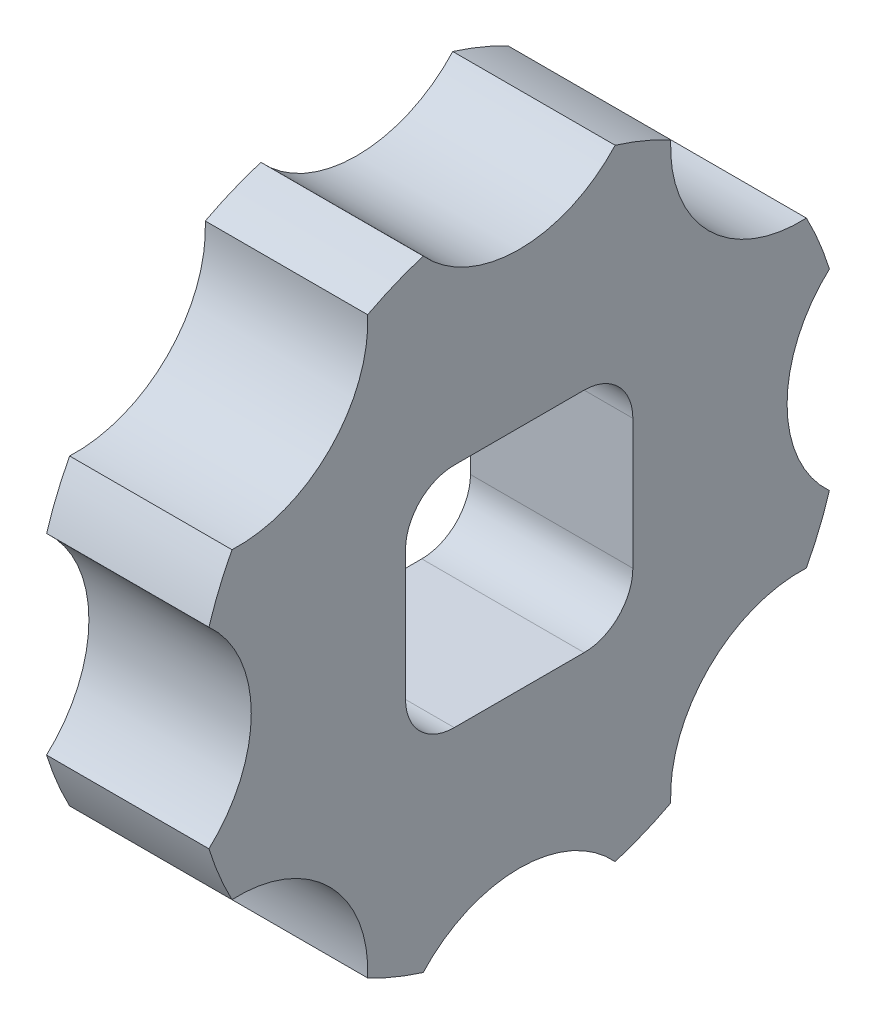
from build123d import *

# Parameters (mm, degrees)
SKETCH1_R           = 20
BOSS_EXTRUDE1_DEPTH = 10
SKETCH2_W           = 14
SKETCH2_H           = 14
CUT_EXTRUDE1_DEPTH  = 10
FILLET1_R           = 3
SKETCH3_R           = 8
CUT_EXTRUDE2_DEPTH  = 10
SKETCH3_3_R         = 8
CUT_EXTRUDE3_DEPTH  = 10
CIRPATTERN2_COUNT   = 8


with BuildPart() as part:
    # Sketch1 → Boss-Extrude1 (new body)
    with BuildSketch(Plane(origin=(0, 0, 0), x_dir=(0, 0, -1), z_dir=(1, 0, 0))):
        Circle(SKETCH1_R)
    extrude(amount=BOSS_EXTRUDE1_DEPTH)

    # Sketch2 → Cut-Extrude1 (cut)
    with BuildSketch(Plane(origin=(10, 0, 0), x_dir=(0, 0, -1), z_dir=(1, 0, 0))):
        Rectangle(SKETCH2_W, SKETCH2_H)
    extrude(amount=-CUT_EXTRUDE1_DEPTH, mode=Mode.SUBTRACT)

    # Fillet1
    fillet1_edges = [part.edges().sort_by_distance(p)[0] for p in [
        (5, -7, 7),
        (5, -7, -7),
        (5, 7, 7),
        (5, 7, -7),
    ]]
    fillet(fillet1_edges, radius=FILLET1_R)

    # Sketch3 → Cut-Extrude2 (cut)
    with BuildSketch(Plane(origin=(10, 0, 0), x_dir=(0, 0, -1), z_dir=(1, 0, 0))):
        with Locations((-24.5, 0)):
            Circle(SKETCH3_R)
    cut_extrude2 = extrude(amount=-CUT_EXTRUDE2_DEPTH, mode=Mode.SUBTRACT)

    # Sketch3<3> → Cut-Extrude3 (cut)
    with BuildSketch(Plane(origin=(10, 0, 0), x_dir=(0, 0, -1), z_dir=(1, 0, 0))):
        with Locations((24.5, 0)):
            Circle(SKETCH3_3_R)
        with Locations((-24.5, 0)):
            Circle(SKETCH3_3_R)
    extrude(amount=-CUT_EXTRUDE3_DEPTH, mode=Mode.SUBTRACT)

    # CirPattern2: Cut-Extrude2 ×8 about axis
    cirpattern2_axis = Axis((10, 0, 0), (1, 0, 0))
    for i in range(1, CIRPATTERN2_COUNT):
        add(cut_extrude2.rotate(cirpattern2_axis, i * 360 / CIRPATTERN2_COUNT), mode=Mode.SUBTRACT)


solid = part.part
